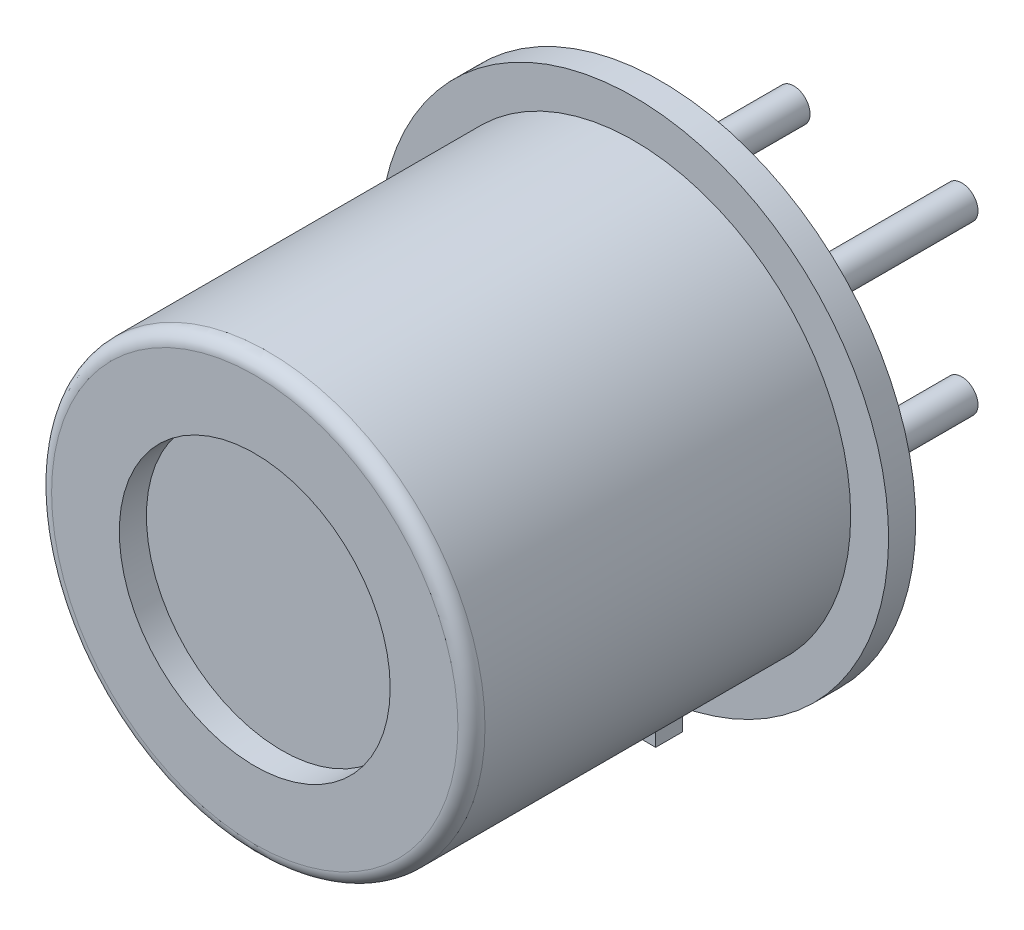
from build123d import *

# Parameters (mm, degrees)
BOSS_EXTRUDE1_DEPTH        = 2
BOSS_EXTRUDE1_DEPTH_BACK   = 2
SKETCH1_R                  = 0.3
BOSS_EXTRUDE1_2_DEPTH      = 2
BOSS_EXTRUDE1_2_DEPTH_BACK = 2
BOSS_EXTRUDE1_3_DEPTH      = 2
BOSS_EXTRUDE1_3_DEPTH_BACK = 2
BOSS_EXTRUDE1_4_DEPTH      = 2
BOSS_EXTRUDE1_4_DEPTH_BACK = 2
BOSS_EXTRUDE2_DEPTH        = 0.5
SKETCH3_R                  = 4
BOSS_EXTRUDE3_DEPTH        = 7
FILLET1_R                  = 0.25
SKETCH4_R                  = 2.5
CUT_EXTRUDE1_DEPTH         = 0.5


with BuildPart() as part:
    # Sketch1 → Boss-Extrude1 (new, two sides: drawn at the far end of the back side and taken through both)
    with BuildSketch(Plane.XY.offset(-BOSS_EXTRUDE1_DEPTH_BACK)):
        with Locations((-1.55, 1.55)):
            Circle(SKETCH1_R)
    extrude(amount=BOSS_EXTRUDE1_DEPTH + BOSS_EXTRUDE1_DEPTH_BACK)



with BuildPart() as body_2:
    # Sketch1 → Boss-Extrude1 2 (new, two sides: drawn at the far end of the back side and taken through both)
    with BuildSketch(Plane.XY.offset(-BOSS_EXTRUDE1_2_DEPTH_BACK)):
        with Locations((-1.55, -1.55)):
            Circle(SKETCH1_R)
    extrude(amount=BOSS_EXTRUDE1_2_DEPTH + BOSS_EXTRUDE1_2_DEPTH_BACK)


with BuildPart() as body_3:
    # Sketch1 → Boss-Extrude1 3 (new, two sides: drawn at the far end of the back side and taken through both)
    with BuildSketch(Plane.XY.offset(-BOSS_EXTRUDE1_3_DEPTH_BACK)):
        with Locations((1.55, 1.55)):
            Circle(SKETCH1_R)
    extrude(amount=BOSS_EXTRUDE1_3_DEPTH + BOSS_EXTRUDE1_3_DEPTH_BACK)


with BuildPart() as body_4:
    # Sketch1 → Boss-Extrude1 4 (new, two sides: drawn at the far end of the back side and taken through both)
    with BuildSketch(Plane.XY.offset(-BOSS_EXTRUDE1_4_DEPTH_BACK)):
        with Locations((1.55, -1.55)):
            Circle(SKETCH1_R)
    extrude(amount=BOSS_EXTRUDE1_4_DEPTH + BOSS_EXTRUDE1_4_DEPTH_BACK)


with BuildPart() as part_1:
    add(part.part)

    add(body_2.part)  # Boss-Extrude2 merges body 2

    add(body_3.part)  # Boss-Extrude2 merges body 3

    add(body_4.part)  # Boss-Extrude2 merges body 4
    # Sketch2 → Boss-Extrude2 (add)
    with BuildSketch(Plane.XY.offset(2)):
        with BuildLine():
            Line((0, -5.5), (0.4, -5.5))
            Line((0.4, -5.5), (0.4, -4.68294779))
            ThreePointArc((0.4, -4.68294779), (0, 4.7), (-0.4, -4.68294779))
            Line((-0.4, -4.68294779), (-0.4, -5.5))
            Line((-0.4, -5.5), (0, -5.5))
        make_face()
    extrude(amount=BOSS_EXTRUDE2_DEPTH)

    # Sketch3 → Boss-Extrude3 (add)
    with BuildSketch(Plane.XY.offset(2.5)):
        Circle(SKETCH3_R)
    extrude(amount=BOSS_EXTRUDE3_DEPTH)

    # Fillet1
    fillet1_edges = [part_1.edges().sort_by_distance(p)[0] for p in [
        (-4, 0, 9.5),
    ]]
    fillet(fillet1_edges, radius=FILLET1_R)

    # Sketch4 → Cut-Extrude1 (cut)
    with BuildSketch(Plane.XY.offset(9.5)):
        Circle(SKETCH4_R)
    extrude(amount=-CUT_EXTRUDE1_DEPTH, mode=Mode.SUBTRACT)


solid = part_1.part
